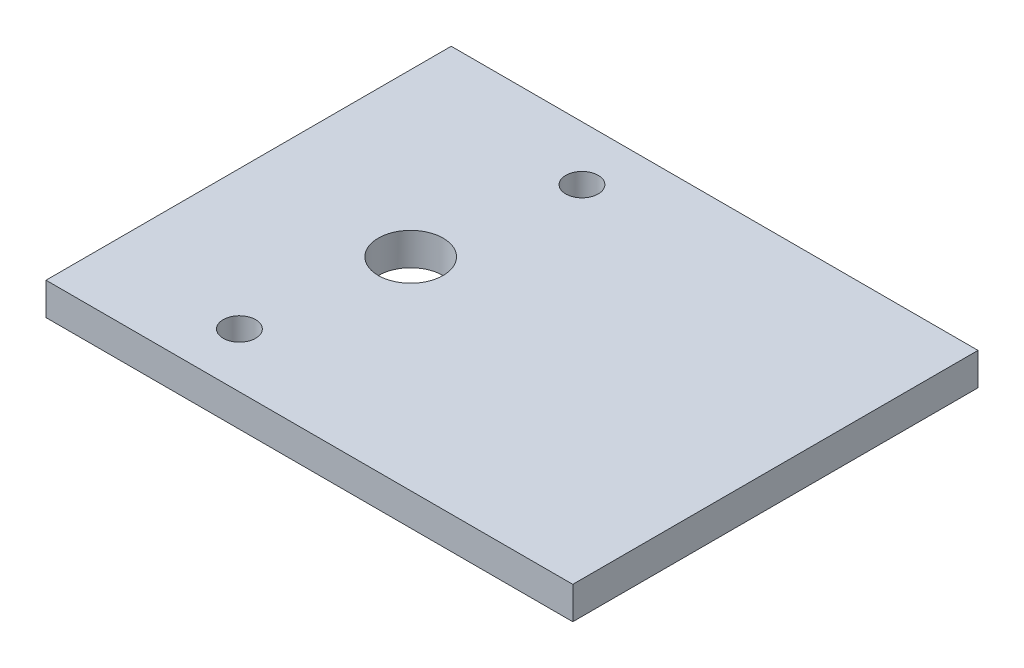
from build123d import *

# Parameters (mm, degrees)
BOSS_EXTRUDE1_DEPTH = 50
SKETCH3_R           = 4
CUT_EXTRUDE1_DEPTH  = 10
SKETCH4_W           = 25
SKETCH4_H           = 50
CUT_EXTRUDE2_DEPTH  = 10
SKETCH6_R           = 2
CUT_EXTRUDE4_DEPTH  = 83.1035931


with BuildPart() as part:
    # Sketch2 → Boss-Extrude1 (new body)
    with BuildSketch(Plane.XY):
        Polygon((4, 4), (90, 4), (90, 0), (0, 0), (0, 4), align=None)
    extrude(amount=BOSS_EXTRUDE1_DEPTH)

    # Sketch3 → Cut-Extrude1 (cut)
    with BuildSketch(Plane(origin=(0, 4, 0), x_dir=(1, 0, 0), z_dir=(0, 1, 0))):
        with Locations(Location((20, -25, 0), (0, 0, 270))):
            Circle(SKETCH3_R)
    extrude(amount=-CUT_EXTRUDE1_DEPTH, mode=Mode.SUBTRACT)

    # Sketch4 → Cut-Extrude2 (cut)
    with BuildSketch(Plane(origin=(0, 4, 0), x_dir=(1, 0, 0), z_dir=(0, 1, 0))):
        with Locations((77.5, -25)):
            Rectangle(SKETCH4_W, SKETCH4_H)
    extrude(amount=-CUT_EXTRUDE2_DEPTH, mode=Mode.SUBTRACT)

    # Sketch6 → Cut-Extrude4 (cut, through all)
    with BuildSketch(Plane(origin=(0, 4, 0), x_dir=(1, 0, 0), z_dir=(0, 1, 0))):
        with Locations(Location((17.143662574, -43.278165567, 0), (0, 0, 180))):
            Circle(SKETCH6_R)
        with Locations(Location((22.856337427, -6.721834433, 0), (0, 0, 180))):
            Circle(SKETCH6_R)
    extrude(amount=-CUT_EXTRUDE4_DEPTH, mode=Mode.SUBTRACT)


solid = part.part
